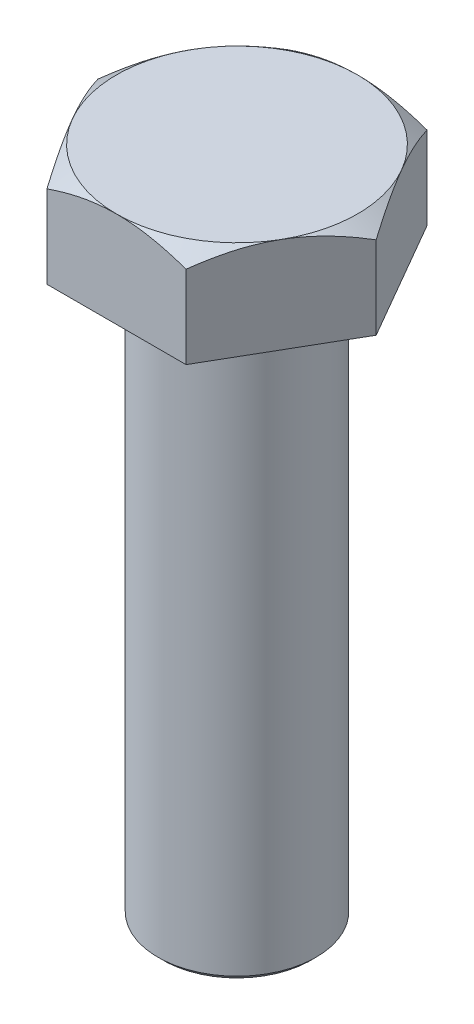
from build123d import *

# Parameters (mm, degrees)
SKETCH_2_OUTSIDE_W  = 26.932
SKETCH_2_OUTSIDE_H  = 26.932
CUT_EXTRUDE_1_DEPTH = 5.5
CUT_EXTRUDE_START   = 5.5
SKETCH_3_OUTSIDE_W  = 34.642
SKETCH_3_OUTSIDE_H  = 32.498
SKETCH_3_OUTSIDE_R  = 6.92820323
CUT_EXTRUDE_2_DEPTH = 2.75
CUT_EXTRUDE_2_DRAFT = -55
CHAMFER_1_SIZE      = 0.3


with BuildPart() as part:
    # 草图1 → 旋转1 (revolve)
    with BuildSketch(Plane.XY, mode=Mode.PRIVATE) as revolve_1_sk:
        Polygon((0, 5.5), (8, 5.5), (8, 0), (4.545454545, 0), (4.545454545, -33), (0, -33), align=None)
    revolve(revolve_1_sk.sketch.rotate(Axis((0, 0, 0), (0, 1, 0)), 90), axis=Axis((0, 0, 0), (0, 1, 0)))

    # 草图2 outside → 切除-拉伸1 (cut)
    with BuildSketch(Plane(origin=(0, 0, 0), x_dir=(1, 0, 0), z_dir=(0, 1, 0))):
        Rectangle(SKETCH_2_OUTSIDE_W, SKETCH_2_OUTSIDE_H)
        Polygon((8, 0), (4, 6.92820323), (-4, 6.92820323), (-8, 0), (-4, -6.92820323), (4, -6.92820323), align=None, mode=Mode.SUBTRACT)
    extrude(amount=CUT_EXTRUDE_1_DEPTH, mode=Mode.SUBTRACT)


with BuildPart() as cut_extrude_2_tool:
    # 草图3 outside → 切除-拉伸2 (with draft: the straight prism first)
    with BuildSketch(Plane(origin=(0, 0, 0), x_dir=(1, 0, 0), z_dir=(0, 1, 0)).offset(CUT_EXTRUDE_START)):
        Rectangle(SKETCH_3_OUTSIDE_W, SKETCH_3_OUTSIDE_H)
        Circle(SKETCH_3_OUTSIDE_R, mode=Mode.SUBTRACT)
    extrude(amount=-CUT_EXTRUDE_2_DEPTH)
    # 切除-拉伸2: the draft: its side faces are tilted about the plane it starts from
    cut_extrude_2_sides = [cut_extrude_2_tool.faces().sort_by_distance(p)[0] for p in [
        (0, 4.125, 16.249),
        (17.321, 4.125, 0),
        (0, 4.125, -16.249),
        (-17.321, 4.125, 0),
        (-6.92820323, 4.125, 0),
    ]]
    draft(cut_extrude_2_sides, Plane(origin=(0, 0, 0), x_dir=(1, 0, 0), z_dir=(0, 1, 0)).offset(CUT_EXTRUDE_START), CUT_EXTRUDE_2_DRAFT)


with BuildPart() as part_1:
    add(part.part)

    # 切除-拉伸2: cut by cut_extrude_2_tool
    add(cut_extrude_2_tool.part, mode=Mode.SUBTRACT)

    # 倒角1
    chamfer_1_edges = [part_1.edges().sort_by_distance(p)[0] for p in [
        (0, -33, 4.545454545),
    ]]
    chamfer(chamfer_1_edges, length=CHAMFER_1_SIZE)


solid = part_1.part
